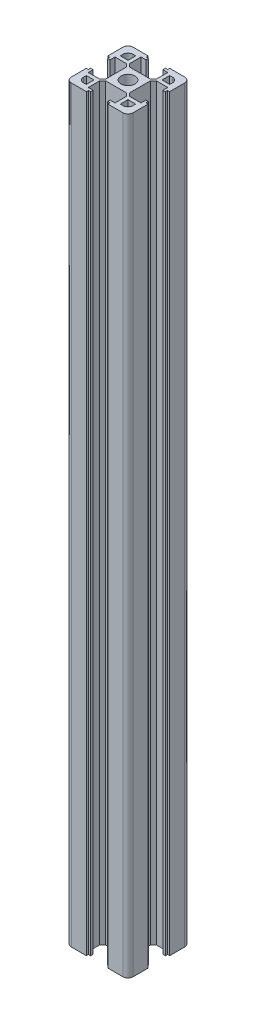
from build123d import *

# Parameters (mm, degrees)
SKETCH_1_R      = 3.4
EXTRUDE_1_DEPTH = 363


with BuildPart() as part:
    # 草图1 → 凸台-拉伸1 (new body)
    with BuildSketch(Plane(origin=(0, 0, 0), x_dir=(1, 0, 0), z_dir=(0, 1, 0))):
        with BuildLine():
            Line((-12.8, 4.1), (-12.8, 6.495575748))
            Line((-12.8, 6.495575748), (-7.273393207, 6.495575748))
            Line((-7.273393207, 6.495575748), (-5.8, 5.022182541))
            Line((-5.8, 5.022182541), (-5.8, 0))
            Line((-5.8, 0), (-5.8, -5.022182541))
            Line((-5.8, -5.022182541), (-7.273393207, -6.495575748))
            Line((-7.273393207, -6.495575748), (-12.8, -6.495575748))
            Line((-12.8, -6.495575748), (-12.8, -4.1))
            Line((-12.8, -4.1), (-14, -4.1))
            Line((-14, -4.1), (-14, -5.2))
            Line((-14, -5.2), (-15, -5.2))
            Line((-15, -5.2), (-15, -12.5))
            ThreePointArc((-15, -12.5), (-14.267766953, -14.267766953), (-12.5, -15))
            Line((-12.5, -15), (-5.2, -15))
            Line((-5.2, -15), (-5.2, -14))
            Line((-5.2, -14), (-4.1, -14))
            Line((-4.1, -14), (-4.1, -12.8))
            Line((-4.1, -12.8), (-6.495575748, -12.8))
            Line((-6.495575748, -12.8), (-6.495575748, -7.273393207))
            Line((-6.495575748, -7.273393207), (-5.022182541, -5.8))
            Line((-5.022182541, -5.8), (0, -5.8))
            Line((0, -5.8), (5.022182541, -5.8))
            Line((5.022182541, -5.8), (6.495575748, -7.273393207))
            Line((6.495575748, -7.273393207), (6.495575748, -12.8))
            Line((6.495575748, -12.8), (4.1, -12.8))
            Line((4.1, -12.8), (4.1, -14))
            Line((4.1, -14), (5.2, -14))
            Line((5.2, -14), (5.2, -15))
            Line((5.2, -15), (12.5, -15))
            ThreePointArc((12.5, -15), (14.267766953, -14.267766953), (15, -12.5))
            Line((15, -12.5), (15, -5.2))
            Line((15, -5.2), (14, -5.2))
            Line((14, -5.2), (14, -4.1))
            Line((14, -4.1), (12.8, -4.1))
            Line((12.8, -4.1), (12.8, -6.495575748))
            Line((12.8, -6.495575748), (7.273393207, -6.495575748))
            Line((7.273393207, -6.495575748), (5.8, -5.022182541))
            Line((5.8, -5.022182541), (5.8, 0))
            Line((5.8, 0), (5.8, 5.022182541))
            Line((5.8, 5.022182541), (7.273393207, 6.495575748))
            Line((7.273393207, 6.495575748), (12.8, 6.495575748))
            Line((12.8, 6.495575748), (12.8, 4.1))
            Line((12.8, 4.1), (14, 4.1))
            Line((14, 4.1), (14, 5.2))
            Line((14, 5.2), (15, 5.2))
            Line((15, 5.2), (15, 12.5))
            ThreePointArc((15, 12.5), (14.267766953, 14.267766953), (12.5, 15))
            Line((12.5, 15), (5.2, 15))
            Line((5.2, 15), (5.2, 14))
            Line((5.2, 14), (4.1, 14))
            Line((4.1, 14), (4.1, 12.8))
            Line((4.1, 12.8), (6.495575748, 12.8))
            Line((6.495575748, 12.8), (6.495575748, 7.273393207))
            Line((6.495575748, 7.273393207), (5.022182541, 5.8))
            Line((5.022182541, 5.8), (0, 5.8))
            Line((0, 5.8), (-5.022182541, 5.8))
            Line((-5.022182541, 5.8), (-6.495575748, 7.273393207))
            Line((-6.495575748, 7.273393207), (-6.495575748, 12.8))
            Line((-6.495575748, 12.8), (-4.1, 12.8))
            Line((-4.1, 12.8), (-4.1, 14))
            Line((-4.1, 14), (-5.2, 14))
            Line((-5.2, 14), (-5.2, 15))
            Line((-5.2, 15), (-12.5, 15))
            ThreePointArc((-12.5, 15), (-14.267766953, 14.267766953), (-15, 12.5))
            Line((-15, 12.5), (-15, 5.2))
            Line((-15, 5.2), (-14, 5.2))
            Line((-14, 5.2), (-14, 4.1))
            Line((-14, 4.1), (-12.8, 4.1))
        make_face()
        with Locations(Location((0, 0, 0), (0, 0, 270))):
            Circle(SKETCH_1_R, mode=Mode.SUBTRACT)
        with BuildLine():
            Line((-12, 9.5), (-12, 8.25))
            Line((-12, 8.25), (-8.25, 8.25))
            Line((-8.25, 8.25), (-8.25, 12))
            Line((-8.25, 12), (-9.5, 12))
            ThreePointArc((-9.5, 12), (-11.267766953, 11.267766953), (-12, 9.5))
        make_face(mode=Mode.SUBTRACT)
        with BuildLine():
            Line((9.5, 12), (8.25, 12))
            Line((8.25, 12), (8.25, 8.25))
            Line((8.25, 8.25), (12, 8.25))
            Line((12, 8.25), (12, 9.5))
            ThreePointArc((12, 9.5), (11.267766953, 11.267766953), (9.5, 12))
        make_face(mode=Mode.SUBTRACT)
        with BuildLine():
            Line((12, -9.5), (12, -8.25))
            Line((12, -8.25), (8.25, -8.25))
            Line((8.25, -8.25), (8.25, -12))
            Line((8.25, -12), (9.5, -12))
            ThreePointArc((9.5, -12), (11.267766953, -11.267766953), (12, -9.5))
        make_face(mode=Mode.SUBTRACT)
        with BuildLine():
            Line((-9.5, -12), (-8.25, -12))
            Line((-8.25, -12), (-8.25, -8.25))
            Line((-8.25, -8.25), (-12, -8.25))
            Line((-12, -8.25), (-12, -9.5))
            ThreePointArc((-12, -9.5), (-11.267766953, -11.267766953), (-9.5, -12))
        make_face(mode=Mode.SUBTRACT)
    extrude(amount=EXTRUDE_1_DEPTH)


solid = part.part
